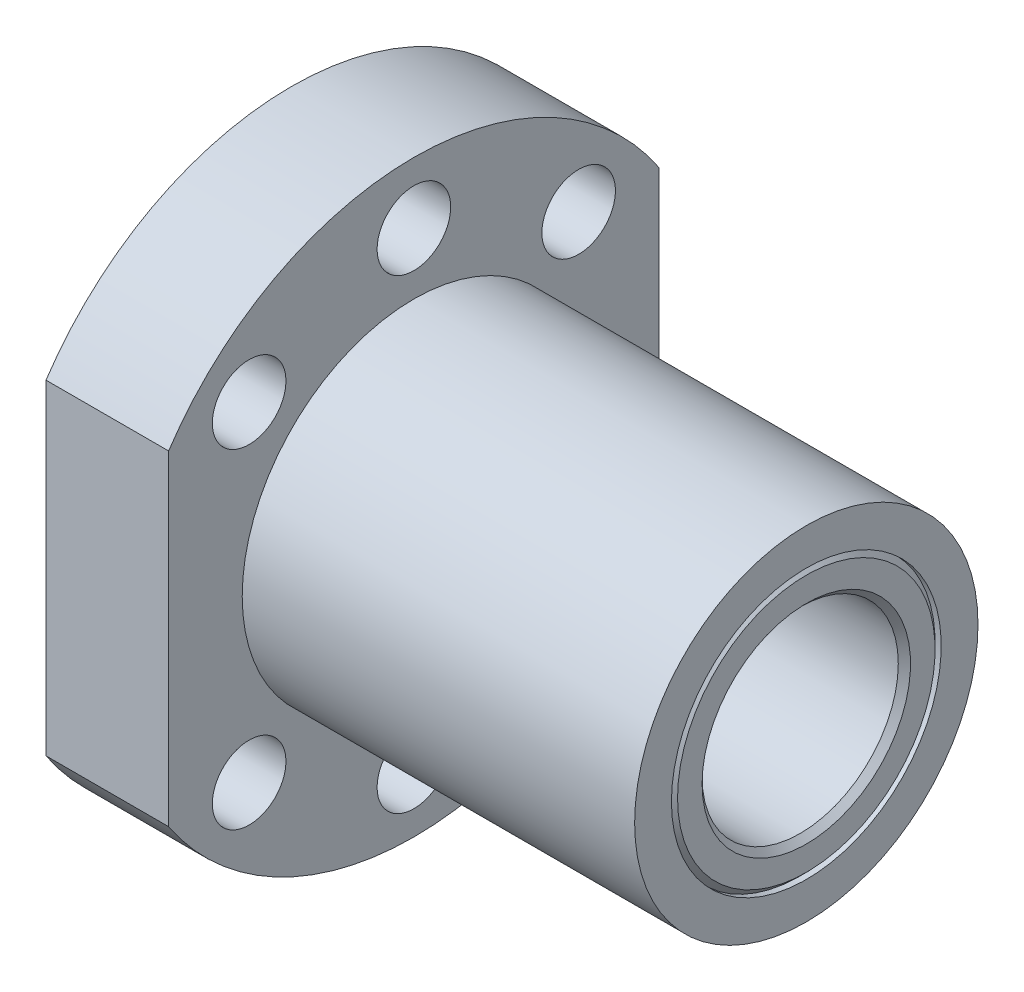
from build123d import *

# Parameters (mm, degrees)
SKETCH_2_W          = 60
SKETCH_2_H          = 68
SKETCH_2_W_2        = 40
SKETCH_2_H_2        = 48
CUT_EXTRUDE_1_DEPTH = 55
SKETCH_3_R          = 3
CUT_EXTRUDE_2_DEPTH = 53.345009313
SKETCH_4_R          = 11
SKETCH_4_R_2        = 8
EXTRUDE_1_DEPTH     = 42
CHAMFER_1_SIZE      = 0.5


with BuildPart() as part:
    # Эскиз1 → Повернуть1 (revolve)
    with BuildSketch(Plane.XY, mode=Mode.PRIVATE) as revolve_1_sk:
        Polygon((0, 11), (0, 24), (10, 24), (10, 14), (42, 14), (42, 11), align=None)
    revolve(revolve_1_sk.sketch.rotate(Axis((0, 0, 0), (1, 0, 0)), 90), axis=Axis((0, 0, 0), (1, 0, 0)))

    # Эскиз2 → Вырез-Вытянуть1 (cut, through all)
    with BuildSketch(Plane.ZY):
        Rectangle(SKETCH_2_W, SKETCH_2_H)
        Rectangle(SKETCH_2_W_2, SKETCH_2_H_2, mode=Mode.SUBTRACT)
    extrude(amount=-CUT_EXTRUDE_1_DEPTH, mode=Mode.SUBTRACT)

    # Эскиз3 → Вырез-Вытянуть2 (cut, through all)
    with BuildSketch(Plane.ZY):
        with Locations((0, 19)):
            Circle(SKETCH_3_R)
        with Locations((13.435028843, 13.435028843)):
            Circle(SKETCH_3_R)
        with Locations((-13.435028843, 13.435028843)):
            Circle(SKETCH_3_R)
        with Locations((-13.435028843, -13.435028843)):
            Circle(SKETCH_3_R)
        with Locations((0, -19)):
            Circle(SKETCH_3_R)
        with Locations((13.435028843, -13.435028843)):
            Circle(SKETCH_3_R)
    extrude(amount=-CUT_EXTRUDE_2_DEPTH, mode=Mode.SUBTRACT)


with BuildPart() as body_2:
    # Эскиз4 → Бобышка-Вытянуть1 (new body)
    with BuildSketch(Plane(origin=(0, 0, 0), x_dir=(0, 0, -1), z_dir=(1, 0, 0))):
        with Locations(Location((0, 0, 0), (0, 0, 180))):
            Circle(SKETCH_4_R)
        with Locations(Location((0, 0, 0), (0, 0, 180))):
            Circle(SKETCH_4_R_2, mode=Mode.SUBTRACT)
    extrude(amount=EXTRUDE_1_DEPTH)

    # Фаска1
    chamfer_1_edges = [body_2.edges().sort_by_distance(p)[0] for p in [
        (0, 0, -11),
        (42, 0, -8),
        (0, 0, -8),
        (42, 0, -11),
    ]]
    chamfer(chamfer_1_edges, length=CHAMFER_1_SIZE)


solid = Compound([part.part, body_2.part])
